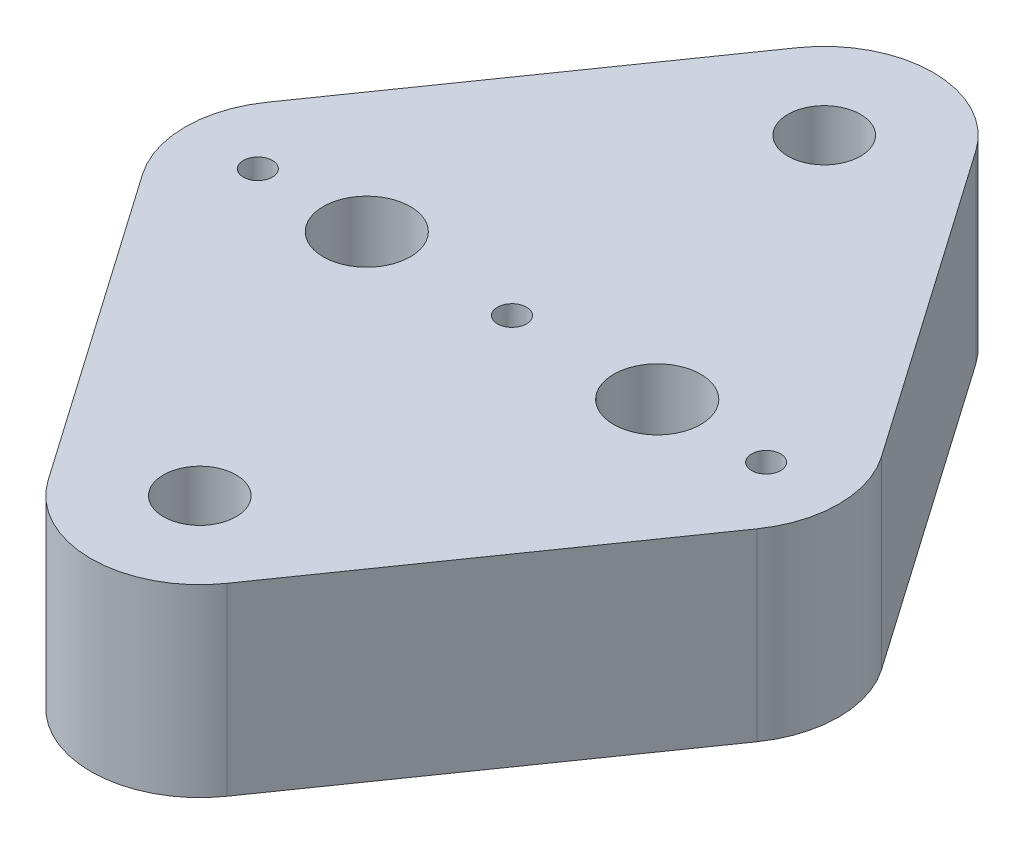
from build123d import *

# Parameters (mm, degrees)
SKETCH1_R                 = 2.5
SKETCH1_R_2               = 3
BOSS_EXTRUDE1_DEPTH       = 6.35
SKETCH2_R                 = 1
POTENTIOMETER_HOLES_DEPTH = 39.839927909


with BuildPart() as part:
    # Sketch1 → Boss-Extrude1 (new, symmetric)
    with BuildSketch(Plane(origin=(0, 0, 0), x_dir=(1, 0, 0), z_dir=(0, 1, 0))):
        with BuildLine():
            Line((-21.150952157, 4.29136197), (-6.150952157, 25.79136197))
            ThreePointArc((-6.150952157, 25.79136197), (0, 29), (6.150952157, 25.79136197))
            Line((6.150952157, 25.79136197), (21.150952157, 4.29136197))
            ThreePointArc((21.150952157, 4.29136197), (22.5, 0), (21.150952157, -4.29136197))
            Line((21.150952157, -4.29136197), (6.150952157, -25.79136197))
            ThreePointArc((6.150952157, -25.79136197), (0, -29), (-6.150952157, -25.79136197))
            Line((-6.150952157, -25.79136197), (-21.150952157, -4.29136197))
            ThreePointArc((-21.150952157, -4.29136197), (-22.5, 0), (-21.150952157, 4.29136197))
        make_face()
        with Locations(Location((0, 21.5, 0), (0, 0, 270))):
            Circle(SKETCH1_R, mode=Mode.SUBTRACT)
        with Locations(Location((0, -21.5, 0), (0, 0, 270))):
            Circle(SKETCH1_R, mode=Mode.SUBTRACT)
        with Locations(Location((-10, 0, 0), (0, 0, 270))):
            Circle(SKETCH1_R_2, mode=Mode.SUBTRACT)
        with Locations(Location((10, 0, 0), (0, 0, 270))):
            Circle(SKETCH1_R_2, mode=Mode.SUBTRACT)
    extrude(amount=BOSS_EXTRUDE1_DEPTH, both=True)

    # Sketch2 → Potentiometer Holes (cut, through all)
    with BuildSketch(Plane(origin=(0, 6.35, 0), x_dir=(1, 0, 0), z_dir=(0, 1, 0))):
        with Locations(Location((-17.5, 0, 0), (0, 0, 270))):
            Circle(SKETCH2_R)
        with Locations(Location((17.5, 0, 0), (0, 0, 270))):
            Circle(SKETCH2_R)
        with Locations(Location((0, 0, 0), (0, 0, 270))):
            Circle(SKETCH2_R)
    extrude(amount=-POTENTIOMETER_HOLES_DEPTH, mode=Mode.SUBTRACT)


solid = part.part
